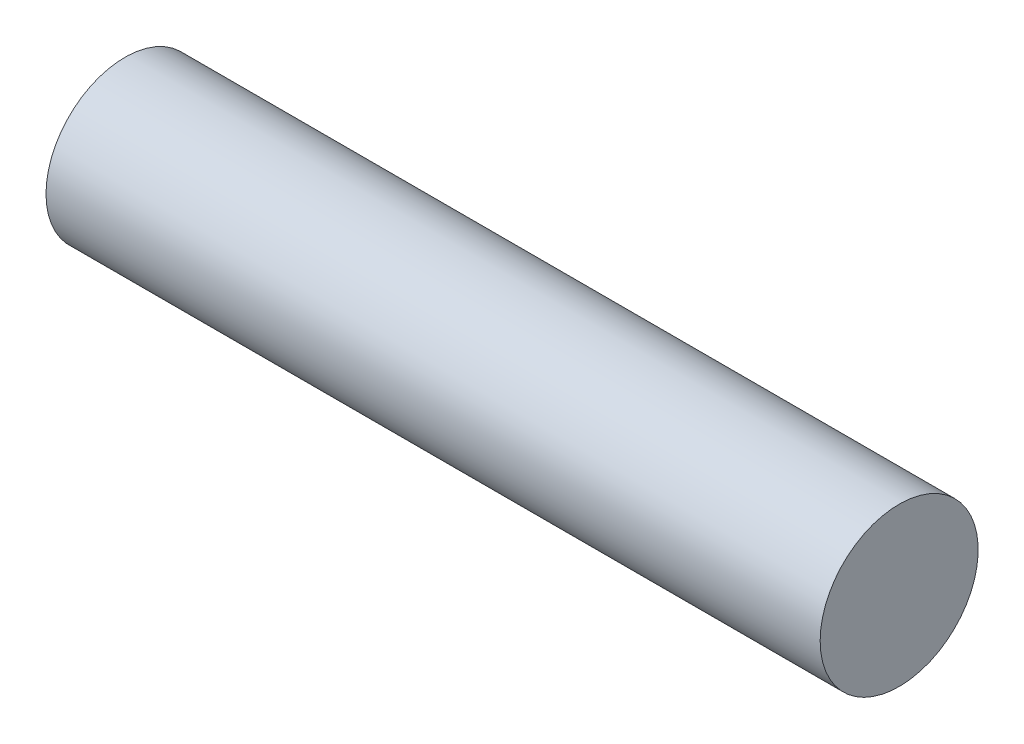
from build123d import *

# Parameters (mm, degrees)
ESBO_O1_W = 49
ESBO_O1_H = 5


with BuildPart() as part:
    # Esboço1 → Revolução1 (revolve)
    with BuildSketch(Plane.XY, mode=Mode.PRIVATE) as revolu_o1_sk:
        with Locations((24.5, 2.5)):
            Rectangle(ESBO_O1_W, ESBO_O1_H)
    revolve(revolu_o1_sk.sketch.rotate(Axis((0, 0, 0), (1, 0, 0)), 90), axis=Axis((0, 0, 0), (1, 0, 0)))


solid = part.part
